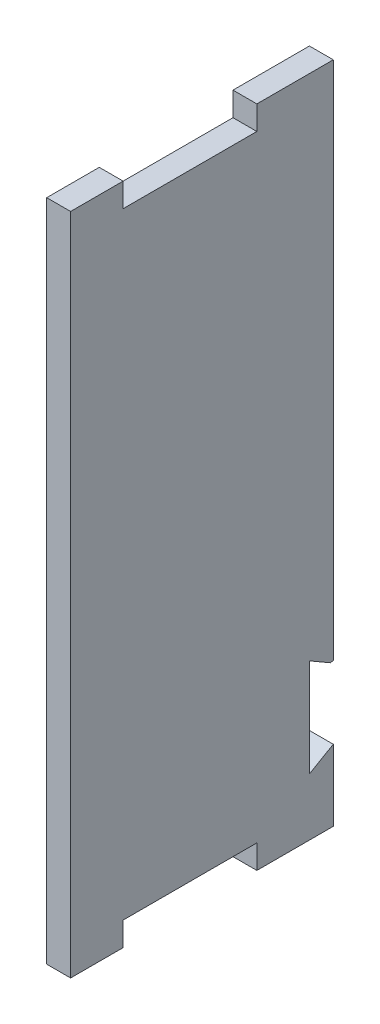
from build123d import *

# Parameters (mm, degrees)
BOSS_EXTRUDE1_DEPTH = 5


with BuildPart() as part:
    # Sketch2 → Boss-Extrude1 (new body)
    with BuildSketch(Plane.YZ):
        Polygon((-69.5, -14), (-69.5, -30), (-54.613248654, -30), (-57.5, -25), (-37, -25), (-39.568874027, -29.449420332), (-39.386751346, -30), (69.5, -30), (69.5, -14), (64.5, -14), (64.5, 14), (69.5, 14), (69.5, 25), (-69.5, 25), (-69.5, 14), (-64.5, 14), (-64.5, -14), align=None)
    extrude(amount=BOSS_EXTRUDE1_DEPTH)


solid = part.part
